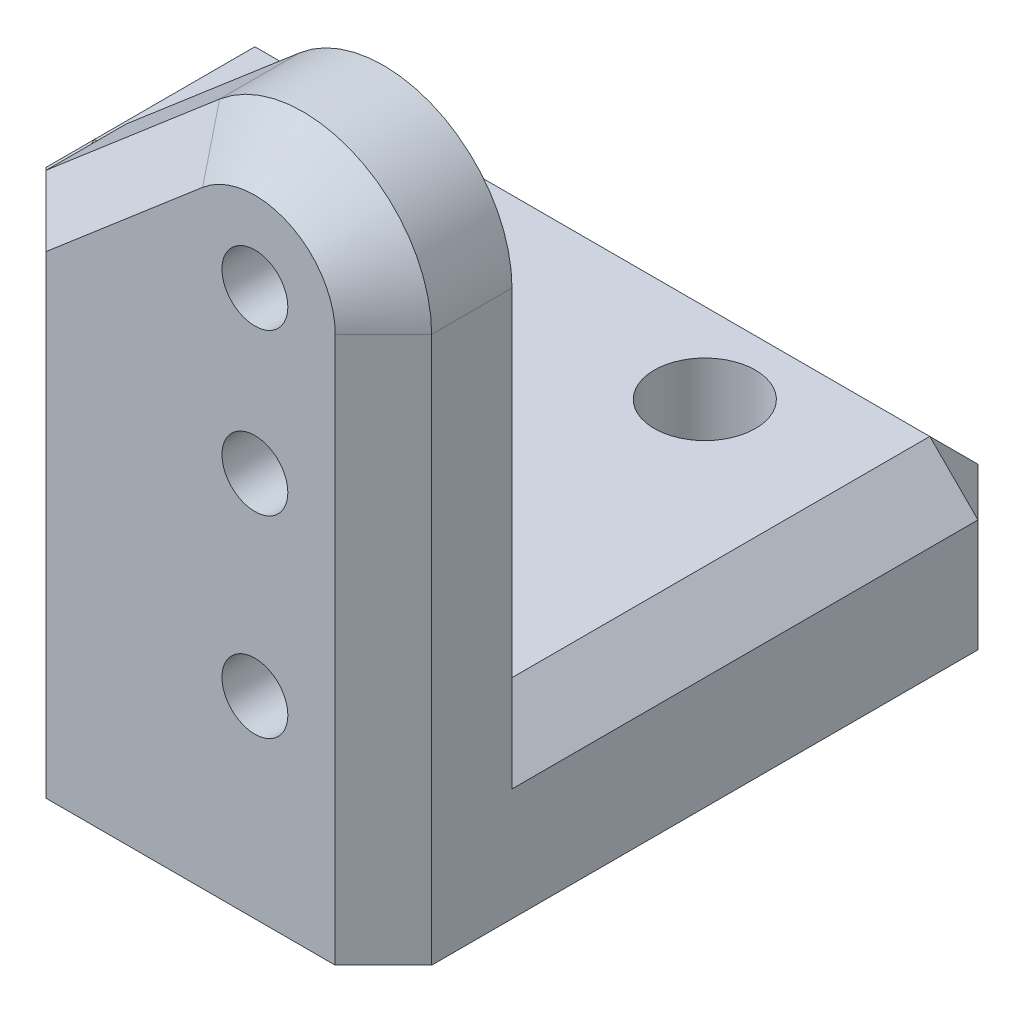
from build123d import *

# Parameters (mm, degrees)
RESSALTO_EXTRUS_O1_DEPTH                      = 20
ESBO_O2_W                                     = 16
ESBO_O2_H                                     = 16
CORTE_EXTRUS_O1_DEPTH                         = 20
CORTE_EXTRUS_O2_DEPTH                         = 34.120990323
CHANFRO2_SIZE                                 = 1.5
FURO_ROSCADO_DE_M2_51_D                       = 2.05
ESBO_O8_W                                     = 8
ESBO_O8_H                                     = 5
RESSALTO_EXTRUS_O2_DEPTH                      = 12
CHANFRO3_SIZE                                 = 1.5
FURO_ROSCADO_PARA_CONDU_TE_DE_M3X0_51_D       = 3.15
BROCA_DE_ROSQUEAR_PARA_TARRAXA_DE_M2_51_D     = 2.05
BROCA_DE_ROSQUEAR_PARA_TARRAXA_DE_M2_51_DEPTH = 4


with BuildPart() as part:
    # Esboço1 → Ressalto-extrusão1 (new body)
    with BuildSketch(Plane.XY):
        with BuildLine():
            Line((0, 0), (0, 12))
            Line((0, 12), (9.400080843, 20.039805977))
            ThreePointArc((9.400080843, 20.039805977), (13.673368365, 20.633158174), (16, 17))
            Line((16, 17), (16, 4))
            Line((16, 4), (16, 0))
            Line((16, 0), (0, 0))
        make_face()
    extrude(amount=RESSALTO_EXTRUS_O1_DEPTH)

    # Esboço2 → Corte-extrusão1 (cut)
    with BuildSketch(Plane(origin=(16, 0, 0), x_dir=(0, 0, -1), z_dir=(1, 0, 0))):
        with Locations((-8, 13)):
            Rectangle(ESBO_O2_W, ESBO_O2_H)
    extrude(amount=-CORTE_EXTRUS_O1_DEPTH, mode=Mode.SUBTRACT)

    # Esboço3 → Corte-extrusão2 (cut, through all)
    with BuildSketch(Plane.XY.offset(20)):
        Polygon((0, 0), (4, 0), (4, 15.42116461), (0, 12), align=None)
    extrude(amount=-CORTE_EXTRUS_O2_DEPTH, mode=Mode.SUBTRACT)

    # Chanfro2
    chanfro2_edges = [part.edges().sort_by_distance(p)[0] for p in [
        (13.673368365, 20.633158174, 20),
        (6.700040421, 17.730485293, 20),
        (4, 7.710582305, 20),
        (16, 8.5, 20),
    ]]
    chamfer(chanfro2_edges, length=CHANFRO2_SIZE)

    # Furo roscado de M2.51 (through all)
    with Locations(Plane(origin=(12, 17, 20), x_dir=(1, 0, 0), z_dir=(0, 0, 1))):
        with Locations((0, 0)):
            Hole(FURO_ROSCADO_DE_M2_51_D / 2)

    # Esboço8 → Ressalto-extrusão2 (add)
    with BuildSketch(Plane.ZY.offset(-4)):
        with Locations((4, 2.5)):
            Rectangle(ESBO_O8_W, ESBO_O8_H)
    extrude(amount=RESSALTO_EXTRUS_O2_DEPTH)

    # Chanfro3
    chanfro3_edges = [part.edges().sort_by_distance(p)[0] for p in [
        (-2, 5, 8),
        (-8, 2.5, 0),
        (-8, 2.5, 8),
        (-8, 5, 4),
        (4, 5, 0),
        (16, 5, 8),
        (16, 2.5, 0),
        (4, 5, 12),
        (4, 2.5, 8),
    ]]
    chamfer(chanfro3_edges, length=CHANFRO3_SIZE)

    # Furo roscado para conduíte de M3x0.51 (through all)
    with Locations(Plane(origin=(-2, 0, 4), x_dir=(0, 0, -1), z_dir=(0, -1, 0))):
        with Locations((0, 0), (0, 12), (-10, 12)):
            Hole(FURO_ROSCADO_PARA_CONDU_TE_DE_M3X0_51_D / 2)

    # Broca de rosquear para tarraxa de M2.51
    with Locations(Plane(origin=(12, 6, 20), x_dir=(1, 0, 0), z_dir=(0, 0, 1))):
        with Locations((0, 0), (0, 6)):
            Hole(BROCA_DE_ROSQUEAR_PARA_TARRAXA_DE_M2_51_D / 2, depth=BROCA_DE_ROSQUEAR_PARA_TARRAXA_DE_M2_51_DEPTH)


solid = part.part
